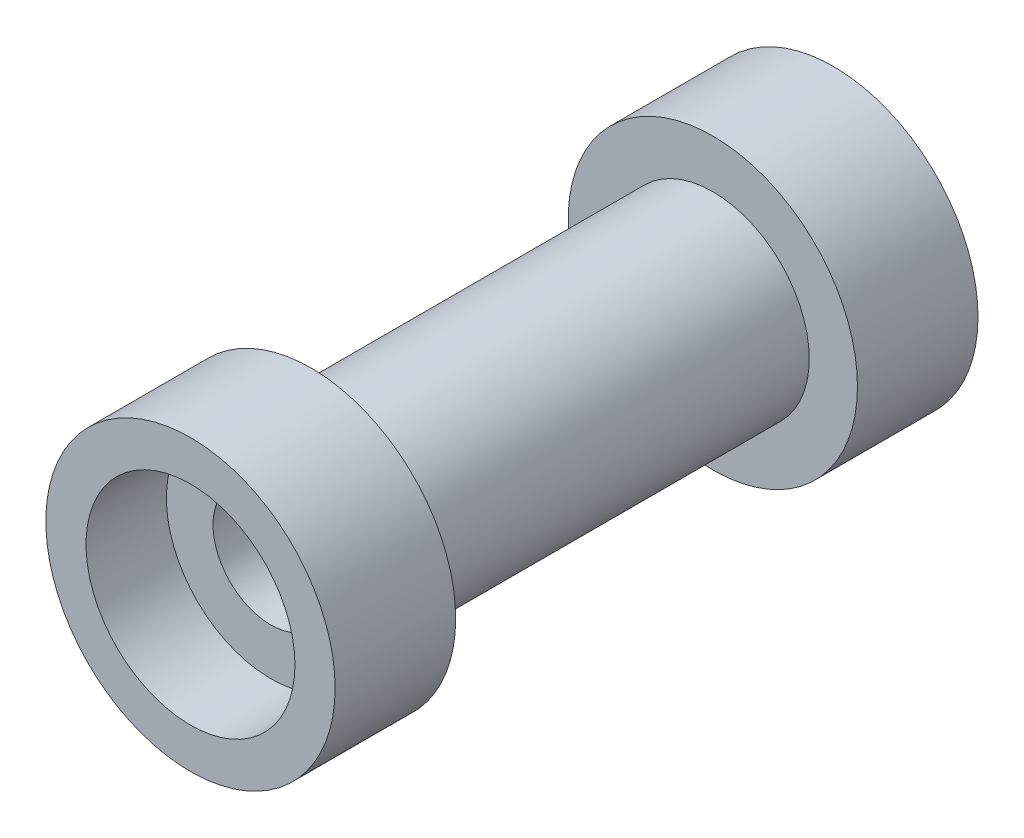
from build123d import *


with BuildPart() as part:
    # Sketch1 → Revolve1 (revolve)
    with BuildSketch(Plane(origin=(0, 0, 0), x_dir=(1, 0, 0), z_dir=(0, 1, 0)), mode=Mode.PRIVATE) as revolve1_sk:
        Polygon((-6, -12.5), (-6, 12.5), (-9, 12.5), (-9, 20), (-6.5, 20), (-6.5, 15), (-3.6, 15), (-3.6, -15), (-6.5, -15), (-6.5, -20), (-9, -20), (-9, -12.5), align=None)
    revolve(revolve1_sk.sketch.rotate(Axis((0, 0, 0), (0, 0, -1)), 180), axis=Axis((0, 0, 0), (0, 0, -1)))


solid = part.part
